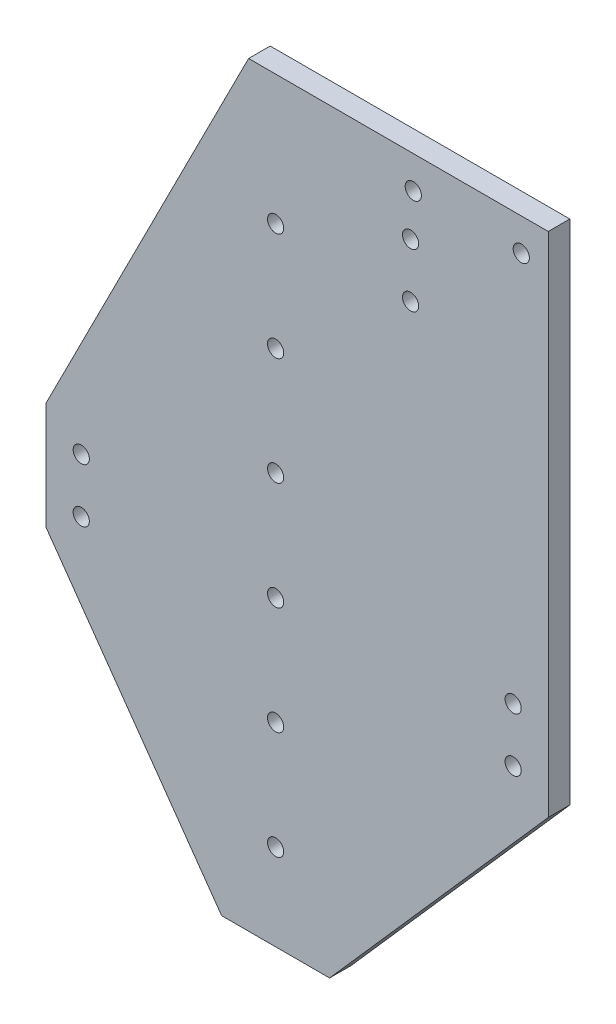
from build123d import *

# Parameters (mm, degrees)
SKETCH_1_R      = 1.5
EXTRUDE_1_DEPTH = 4


with BuildPart() as part:
    # 草图1 → 凸台-拉伸1 (new body)
    with BuildSketch(Plane.XY):
        Polygon((0, 0), (0, 94), (-55.5, 94), (-93, 20), (-93, 0), (-60.5, -46), (-40.5, -46), align=None)
        with Locations((-86.5, 15)):
            Circle(SKETCH_1_R, mode=Mode.SUBTRACT)
        with Locations(Location((-86.5, 5, 0), (0, 0, 180))):
            Circle(SKETCH_1_R, mode=Mode.SUBTRACT)
        with Locations((-6.5, 5)):
            Circle(SKETCH_1_R, mode=Mode.SUBTRACT)
        with Locations(Location((-6.5, 15, 0), (0, 0, 180))):
            Circle(SKETCH_1_R, mode=Mode.SUBTRACT)
        with Locations((-25.5, 80)):
            Circle(SKETCH_1_R, mode=Mode.SUBTRACT)
        with Locations((-25.5, 70)):
            Circle(SKETCH_1_R, mode=Mode.SUBTRACT)
        with Locations((-50.5, 10)):
            Circle(SKETCH_1_R, mode=Mode.SUBTRACT)
        with Locations((-50.5, 30)):
            Circle(SKETCH_1_R, mode=Mode.SUBTRACT)
        with Locations((-50.5, 50)):
            Circle(SKETCH_1_R, mode=Mode.SUBTRACT)
        with Locations((-50.5, -10)):
            Circle(SKETCH_1_R, mode=Mode.SUBTRACT)
        with Locations((-50.5, -30)):
            Circle(SKETCH_1_R, mode=Mode.SUBTRACT)
        with Locations((-5, 88)):
            Circle(SKETCH_1_R, mode=Mode.SUBTRACT)
        with Locations((-25, 88)):
            Circle(SKETCH_1_R, mode=Mode.SUBTRACT)
        with Locations((-50.5, 70)):
            Circle(SKETCH_1_R, mode=Mode.SUBTRACT)
    extrude(amount=EXTRUDE_1_DEPTH)


solid = part.part
